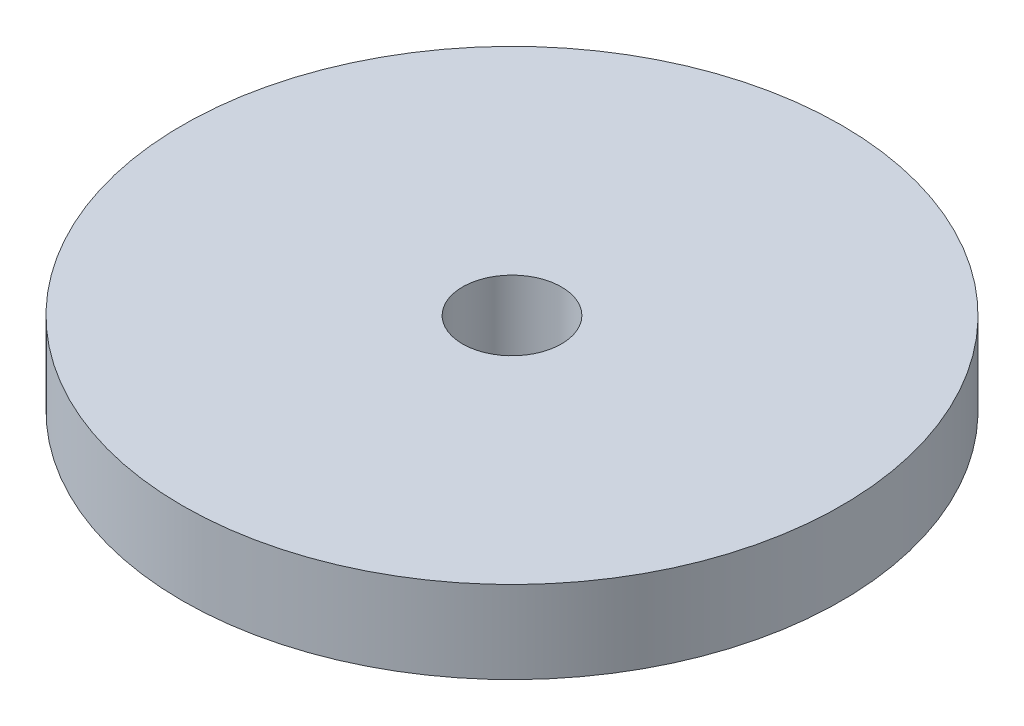
from build123d import *

# Parameters (mm, degrees)
SKETCH2_R           = 10
SKETCH2_R_2         = 1.5
BOSS_EXTRUDE1_DEPTH = 2.5


with BuildPart() as part:
    # Sketch2 → Boss-Extrude1 (new body)
    with BuildSketch(Plane(origin=(0, 0, 0), x_dir=(1, 0, 0), z_dir=(0, 1, 0))):
        with Locations(Location((0, 0, 0), (0, 0, 270))):
            Circle(SKETCH2_R)
        with Locations(Location((0, 0, 0), (0, 0, 270))):
            Circle(SKETCH2_R_2, mode=Mode.SUBTRACT)
    extrude(amount=BOSS_EXTRUDE1_DEPTH)


solid = part.part
